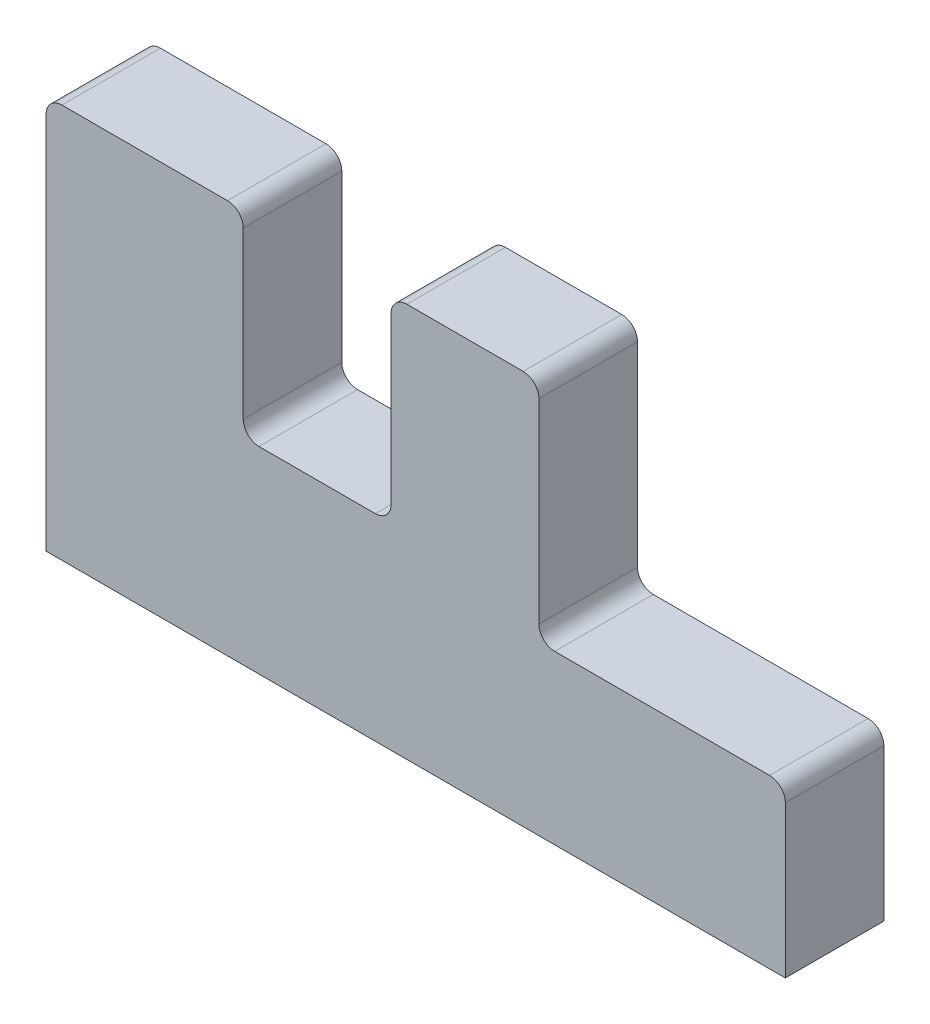
from build123d import *

# Parameters (mm, degrees)
BOSS_EXTRUDE1_DEPTH = 500
FILLET1_R           = 80


with BuildPart() as part:
    # Sketch1 → Boss-Extrude1 (new body)
    with BuildSketch(Plane.XY):
        Polygon((0, 0), (0, 2000), (1000, 2000), (1000, 1000), (1750, 1000), (1750, 2000), (2500, 2000), (2500, 850), (3750, 850), (3750, 0), align=None)
    extrude(amount=BOSS_EXTRUDE1_DEPTH)

    # Fillet1
    fillet1_edges = [part.edges().sort_by_distance(p)[0] for p in [
        (0, 2000, 250),
        (1000, 2000, 250),
        (1000, 1000, 250),
        (1750, 1000, 250),
        (1750, 2000, 250),
        (2500, 2000, 250),
        (2500, 850, 250),
        (3750, 850, 250),
    ]]
    fillet(fillet1_edges, radius=FILLET1_R)


solid = part.part
